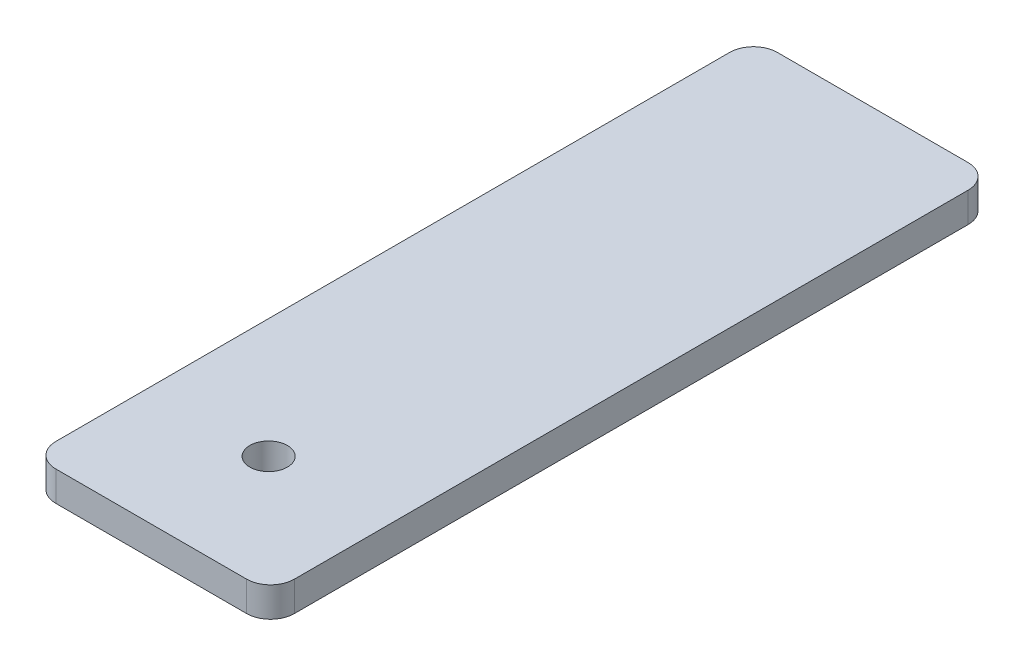
from build123d import *

# Parameters (mm, degrees)
SKETCH1_W           = 25.4
SKETCH1_H           = 76.825
BOSS_EXTRUDE1_DEPTH = 3.175
SKETCH2_R           = 2
CUT_EXTRUDE1_DEPTH  = 63.137257853
FILLET1_R           = 2.54


with BuildPart() as part:
    # Sketch1 → Boss-Extrude1 (new body)
    with BuildSketch(Plane(origin=(0, 0, 0), x_dir=(1, 0, 0), z_dir=(0, 1, 0))):
        with Locations((-13.581081081, 17.803716216)):
            Rectangle(SKETCH1_W, SKETCH1_H)
    extrude(amount=BOSS_EXTRUDE1_DEPTH)

    # Sketch2 → Cut-Extrude1 (cut, through all)
    with BuildSketch(Plane(origin=(0, 3.175, 0), x_dir=(1, 0, 0), z_dir=(0, 1, 0))):
        with Locations(Location((-13.581081081, -8.108783784, 0), (0, 0, 270))):
            Circle(SKETCH2_R)
    extrude(amount=-CUT_EXTRUDE1_DEPTH, mode=Mode.SUBTRACT)

    # Fillet1
    fillet1_edges = [part.edges().sort_by_distance(p)[0] for p in [
        (-26.281081081, 1.5875, -56.216216216),
        (-0.881081081, 1.5875, -56.216216216),
        (-0.881081081, 1.5875, 20.608783784),
        (-26.281081081, 1.5875, 20.608783784),
    ]]
    fillet(fillet1_edges, radius=FILLET1_R)


solid = part.part
